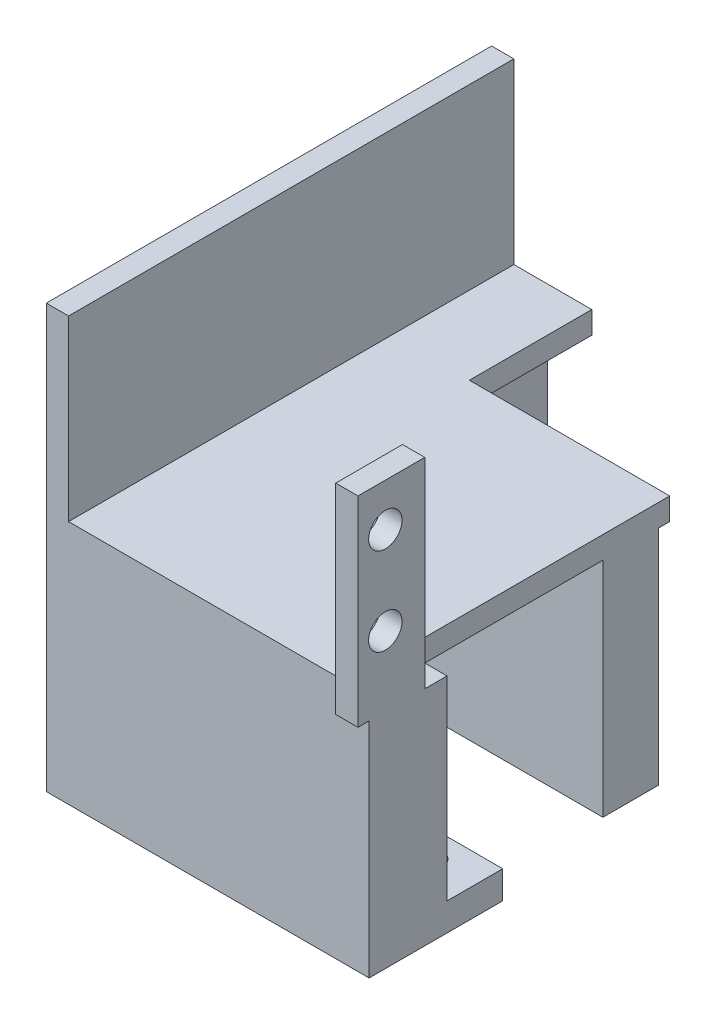
from build123d import *

# Parameters (mm, degrees)
SKETCH1_W           = 31.75
SKETCH1_H           = 54.61
BOSS_EXTRUDE1_DEPTH = 2.54
SKETCH2_W           = 2.54
SKETCH2_H           = 7.62
SKETCH2_H_2         = 54.61
BOSS_EXTRUDE2_DEPTH = 22.86
SKETCH3_W           = 36.83
SKETCH3_H           = 8.89
BOSS_EXTRUDE3_DEPTH = 25.4
SKETCH4_R           = 1.905
CUT_EXTRUDE1_DEPTH  = 2.54
SKETCH5_W           = 36.83
SKETCH5_H           = 25.4
CUT_EXTRUDE2_DEPTH  = 17.78
BOSS_EXTRUDE4_DEPTH = 25.4
SKETCH7_W           = 19.05
SKETCH7_H           = 22.86
CUT_EXTRUDE3_DEPTH  = 25.4
SKETCH8_W           = 3.81
SKETCH8_H           = 48.26
CUT_EXTRUDE4_DEPTH  = 25.4
SKETCH9_W           = 10.16
SKETCH9_H           = 3.175
BOSS_EXTRUDE5_DEPTH = 6.35
SKETCH10_W          = 10.16
SKETCH10_H          = 3.175
BOSS_EXTRUDE6_DEPTH = 6.35
SKETCH11_R          = 1.4224
CUT_EXTRUDE5_DEPTH  = 77.086144107


with BuildPart() as part:
    # Sketch1 → Boss-Extrude1 (new body)
    with BuildSketch(Plane(origin=(0, 0, 0), x_dir=(1, 0, 0), z_dir=(0, 1, 0))):
        with Locations((15.875, 27.305)):
            Rectangle(SKETCH1_W, SKETCH1_H)
    extrude(amount=BOSS_EXTRUDE1_DEPTH)

    # Sketch2 → Boss-Extrude2 (add)
    with BuildSketch(Plane(origin=(0, 0, 0), x_dir=(1, 0, 0), z_dir=(0, 1, 0))):
        with Locations((33.02, 2.54)):
            Rectangle(SKETCH2_W, SKETCH2_H)
        with Locations((33.02, 52.07)):
            Rectangle(SKETCH2_W, SKETCH2_H)
        with Locations((-1.27, 27.305)):
            Rectangle(SKETCH2_W, SKETCH2_H_2)
    extrude(amount=BOSS_EXTRUDE2_DEPTH)

    # Sketch3 → Boss-Extrude3 (add)
    with BuildSketch(Plane.XZ):
        with Locations((15.875, -4.445)):
            Rectangle(SKETCH3_W, SKETCH3_H)
        with Locations((15.875, -50.165)):
            Rectangle(SKETCH3_W, SKETCH3_H)
    extrude(amount=BOSS_EXTRUDE3_DEPTH)

    # Sketch4 → Cut-Extrude1 (cut)
    with BuildSketch(Plane(origin=(34.29, 0, 0), x_dir=(0, 0, -1), z_dir=(1, 0, 0))):
        with Locations((1.85, 17.967840319)):
            Circle(SKETCH4_R)
        with Locations((1.85, 7.967840319)):
            Circle(SKETCH4_R)
        with Locations((52.76, 17.967840319)):
            Circle(SKETCH4_R)
        with Locations((52.76, 7.967840319)):
            Circle(SKETCH4_R)
    extrude(amount=-CUT_EXTRUDE1_DEPTH, mode=Mode.SUBTRACT)

    # Sketch5 → Cut-Extrude2 (cut)
    with BuildSketch(Plane(origin=(0, 0, -54.61), x_dir=(-1, 0, 0), z_dir=(0, 0, -1))):
        with Locations((-15.875, -12.7)):
            Rectangle(SKETCH5_W, SKETCH5_H)
    extrude(amount=-CUT_EXTRUDE2_DEPTH, mode=Mode.SUBTRACT)

    # Sketch6 → Boss-Extrude4 (add)
    with BuildSketch(Plane.XZ):
        Polygon((-2.54, -54.61), (3.81, -54.61), (3.81, -35.56), (31.75, -35.56), (31.75, -29.21), (1.40371894, -29.21), (-2.54, -29.21), align=None)
    extrude(amount=BOSS_EXTRUDE4_DEPTH)

    # Sketch7 → Cut-Extrude3 (cut)
    with BuildSketch(Plane(origin=(34.29, 0, 0), x_dir=(0, 0, -1), z_dir=(1, 0, 0))):
        with Locations((46.355, 11.43)):
            Rectangle(SKETCH7_W, SKETCH7_H)
    extrude(amount=-CUT_EXTRUDE3_DEPTH, mode=Mode.SUBTRACT)

    # Sketch8 → Cut-Extrude4 (cut)
    with BuildSketch(Plane.ZY.offset(2.54)):
        with Locations((-52.705, -1.27)):
            Rectangle(SKETCH8_W, SKETCH8_H)
    extrude(amount=-CUT_EXTRUDE4_DEPTH, mode=Mode.SUBTRACT)

    # Sketch9 → Boss-Extrude5 (add)
    with BuildSketch(Plane(origin=(0, 0, -8.89), x_dir=(-1, 0, 0), z_dir=(0, 0, -1))):
        with Locations((-29.21, -23.8125)):
            Rectangle(SKETCH9_W, SKETCH9_H)
        with Locations((-2.54, -23.8125)):
            Rectangle(SKETCH9_W, SKETCH9_H)
    extrude(amount=BOSS_EXTRUDE5_DEPTH)

    # Sketch10 → Boss-Extrude6 (add)
    with BuildSketch(Plane.ZY.offset(2.54)):
        with Locations((-34.29, -23.8125)):
            Rectangle(SKETCH10_W, SKETCH10_H)
    extrude(amount=BOSS_EXTRUDE6_DEPTH)

    # Sketch11 → Cut-Extrude5 (cut, through all)
    with BuildSketch(Plane(origin=(0, -22.225, 0), x_dir=(1, 0, 0), z_dir=(0, 1, 0))):
        with Locations(Location((29.21, 12.065, 0), (0, 0, 270))):
            Circle(SKETCH11_R)
        with Locations(Location((2.54, 12.065, 0), (0, 0, 270))):
            Circle(SKETCH11_R)
        with Locations(Location((-5.715, 34.29, 0), (0, 0, 270))):
            Circle(SKETCH11_R)
    extrude(amount=-CUT_EXTRUDE5_DEPTH, mode=Mode.SUBTRACT)


solid = part.part
